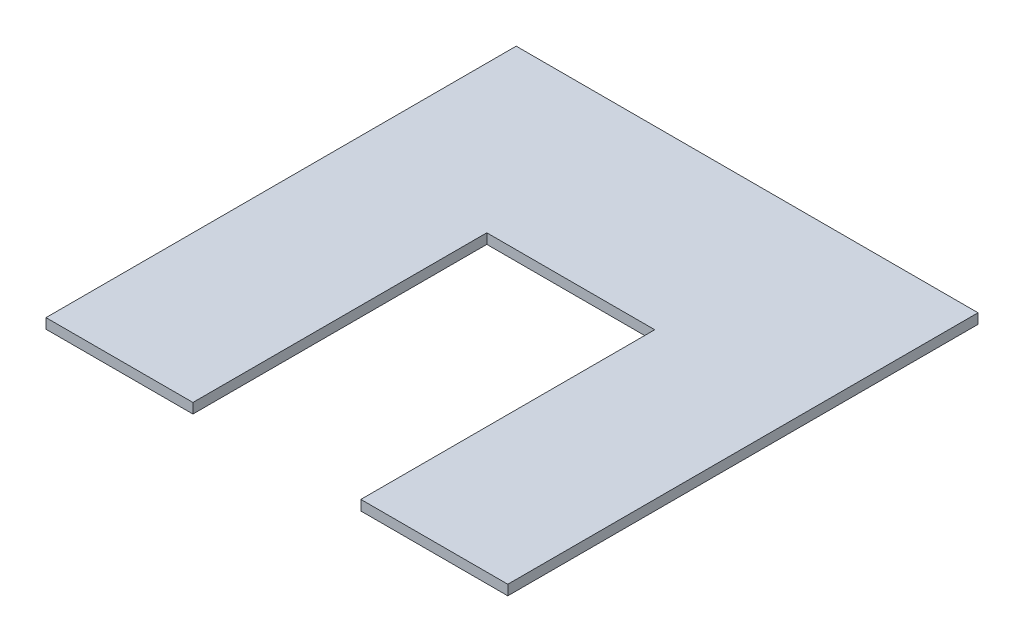
from build123d import *

# Parameters (mm, degrees)
BOSS_EXTRUDE2_DEPTH = 6


with BuildPart() as part:
    # Sketch1 → Boss-Extrude2 (new body)
    with BuildSketch(Plane(origin=(0, 0, 0), x_dir=(1, 0, 0), z_dir=(0, 1, 0))):
        Polygon((-18.369511404, -238.602306438), (-18.369511404, -63.602306438), (81.630488596, -63.602306438), (81.630488596, -238.602306438), (169.130488596, -238.602306438), (169.130488596, 41.397693562), (-105.869511404, 41.397693562), (-105.869511404, -238.602306438), align=None)
    extrude(amount=BOSS_EXTRUDE2_DEPTH)


solid = part.part
